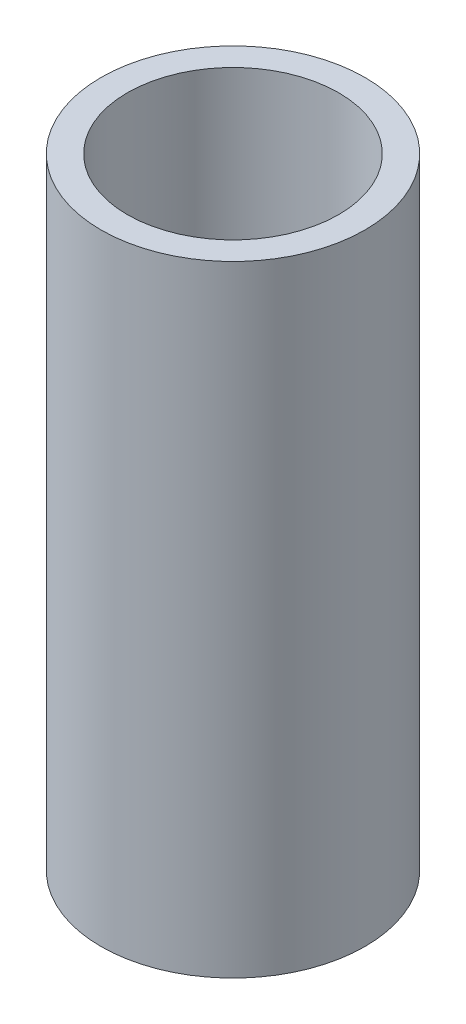
from build123d import *

# Parameters (mm, degrees)
SKETCH2_R           = 63.5
SKETCH2_R_2         = 50.8
BOSS_EXTRUDE1_DEPTH = 298.45


with BuildPart() as part:
    # Sketch2 → Boss-Extrude1 (new body)
    with BuildSketch(Plane(origin=(0, 0, 0), x_dir=(1, 0, 0), z_dir=(0, 1, 0))):
        with Locations(Location((0, 0, 0), (0, 0, 270))):
            Circle(SKETCH2_R)
        with Locations(Location((0, 0, 0), (0, 0, 270))):
            Circle(SKETCH2_R_2, mode=Mode.SUBTRACT)
    extrude(amount=BOSS_EXTRUDE1_DEPTH)


solid = part.part
